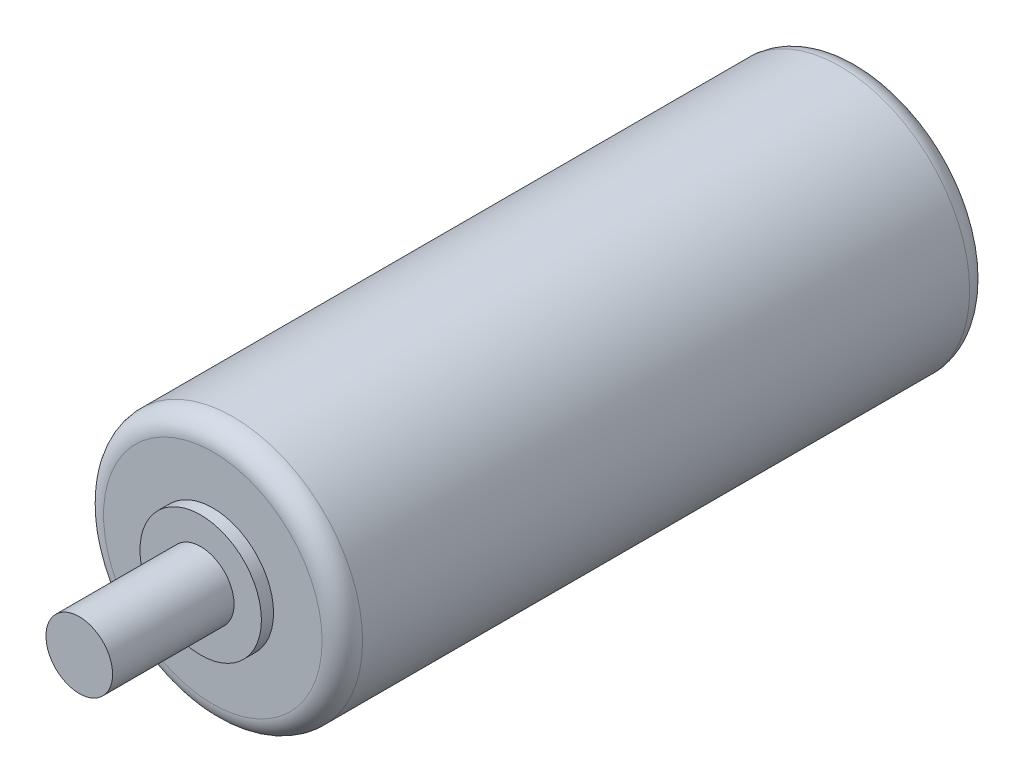
from build123d import *

# Parameters (mm, degrees)
CROQUIS1_R              = 32
SALIENTE_EXTRUIR1_DEPTH = 80
REDONDEO1_R             = 5
CROQUIS2_R              = 15
SALIENTE_EXTRUIR2_DEPTH = 3
CROQUIS3_R              = 17.75
SALIENTE_EXTRUIR3_DEPTH = 6
CROQUIS4_R              = 8.236458785
SALIENTE_EXTRUIR4_DEPTH = 30
CROQUIS5_R              = 3.5
SALIENTE_EXTRUIR5_DEPTH = 5
CROQUIS6_W              = 21.660966918
CROQUIS6_H              = 20.10865689
CORTAR_EXTRUIR2_DEPTH   = 5
CORTAR_EXTRUIR3_DEPTH   = 30


with BuildPart() as part:
    # Croquis1 → Saliente-Extruir1 (new, symmetric)
    with BuildSketch(Plane.XY):
        Circle(CROQUIS1_R)
    extrude(amount=SALIENTE_EXTRUIR1_DEPTH, both=True)

    # Redondeo1
    redondeo1_edges = [part.edges().sort_by_distance(p)[0] for p in [
        (-32, 0, -80),
        (-32, 0, 80),
    ]]
    fillet(redondeo1_edges, radius=REDONDEO1_R)

    # Croquis2 → Saliente-Extruir2 (add)
    with BuildSketch(Plane.XY.offset(80)):
        Circle(CROQUIS2_R)
    extrude(amount=SALIENTE_EXTRUIR2_DEPTH)

    # Croquis3 → Saliente-Extruir3 (add)
    with BuildSketch(Plane(origin=(0, 0, -80), x_dir=(-1, 0, 0), z_dir=(0, 0, -1))):
        with Locations(Location((0, 0, 0), (0, 0, 180))):
            Circle(CROQUIS3_R)
    extrude(amount=SALIENTE_EXTRUIR3_DEPTH)

    # Croquis4 → Saliente-Extruir4 (add)
    with BuildSketch(Plane.XY.offset(83)):
        Circle(CROQUIS4_R)
    extrude(amount=SALIENTE_EXTRUIR4_DEPTH)

    # Croquis5 → Saliente-Extruir5 (add)
    with BuildSketch(Plane(origin=(0, 0, -86), x_dir=(-1, 0, 0), z_dir=(0, 0, -1))):
        with BuildLine():
            Line((-5.5, -8.5), (5.5, -8.5))
            ThreePointArc((5.5, -8.5), (9.881302019, 0), (5.5, 8.5))
            Line((5.5, 8.5), (-5.5, 8.5))
            ThreePointArc((-5.5, 8.5), (-9.881302019, 0), (-5.5, -8.5))
        make_face()
        Circle(CROQUIS5_R, mode=Mode.SUBTRACT)
    extrude(amount=SALIENTE_EXTRUIR5_DEPTH)

    # Croquis6 → Cortar-Extruir2 (cut)
    with BuildSketch(Plane(origin=(0, 0, -91), x_dir=(-1, 0, 0), z_dir=(0, 0, -1))):
        Rectangle(CROQUIS6_W, CROQUIS6_H)
    extrude(amount=-CORTAR_EXTRUIR2_DEPTH, mode=Mode.SUBTRACT)

    # Croquis7 → Cortar-Extruir3 (cut)
    with BuildSketch(Plane(origin=(0, 0, -86), x_dir=(-1, 0, 0), z_dir=(0, 0, -1))):
        with BuildLine():
            Line((5.5, 8.5), (5.5, -8.5))
            ThreePointArc((5.5, -8.5), (0, -10.778174593), (-5.5, -8.5))
            Line((-5.5, -8.5), (-5.5, 8.5))
            ThreePointArc((-5.5, 8.5), (0, 10.778174593), (5.5, 8.5))
        make_face()
    extrude(amount=-CORTAR_EXTRUIR3_DEPTH, mode=Mode.SUBTRACT)


solid = part.part
